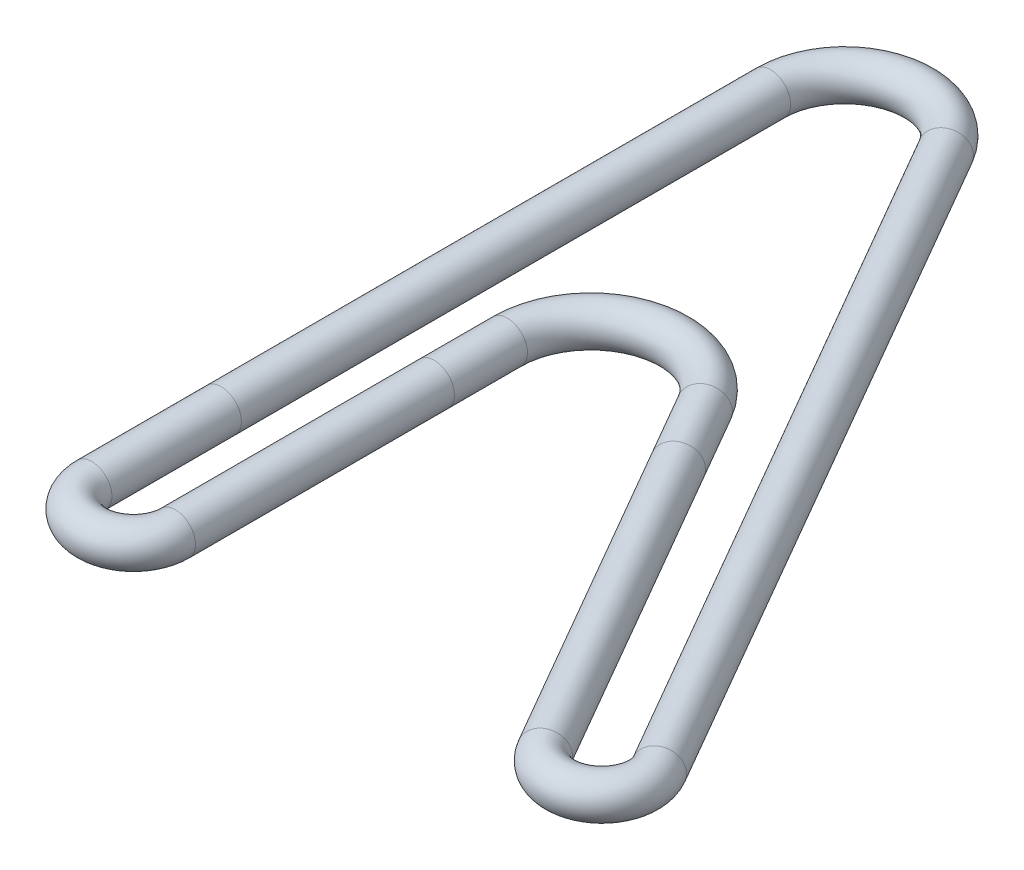
from build123d import *

# Parameters (mm, degrees)
SKETCH2_R = 2.38125


with BuildPart() as part:
    # Sweep1: sweep along a path in Sketch1
    with BuildLine(Plane(origin=(0, 0, 0), x_dir=(-1, 0, 0), z_dir=(0, -1, 0))) as sweep1_path:
        Line((-11.849261314, 89.461703653), (-58.000738686, 9.525))
        ThreePointArc((-58.000738686, 9.525), (-57.07103416, 6.055295474), (-53.601329635, 6.985))
        Line((-53.601329635, 6.985), (-32.17376215, 44.098635567))
        Line((-32.17376215, 44.098635567), (-27.870511969, 51.552083518))
        ThreePointArc((-27.870511969, 51.552083518), (-14.132338403, 57.242621331), (-5.08, 45.445384241))
        Line((-5.08, 45.445384241), (-5.08, 36.838883879))
        Line((-5.08, 36.838883879), (-5.08, 6.35))
        ThreePointArc((-5.08, 6.35), (-2.54, 3.81), (0, 6.35))
        Line((0, 6.35), (0, 86.286703653))
        ThreePointArc((0, 86.286703653), (-4.706499064, 92.420332649), (-11.849261314, 89.461703653))
    # Sketch2 → Sweep1 (sweep)
    with BuildSketch(Plane(origin=(0, 0, -21.594441939), x_dir=(-1, 0, 0), z_dir=(0, 0, -1))):
        with Locations((2.38125, 0)):
            Circle(SKETCH2_R)
    sweep(path=sweep1_path.line)


solid = part.part
